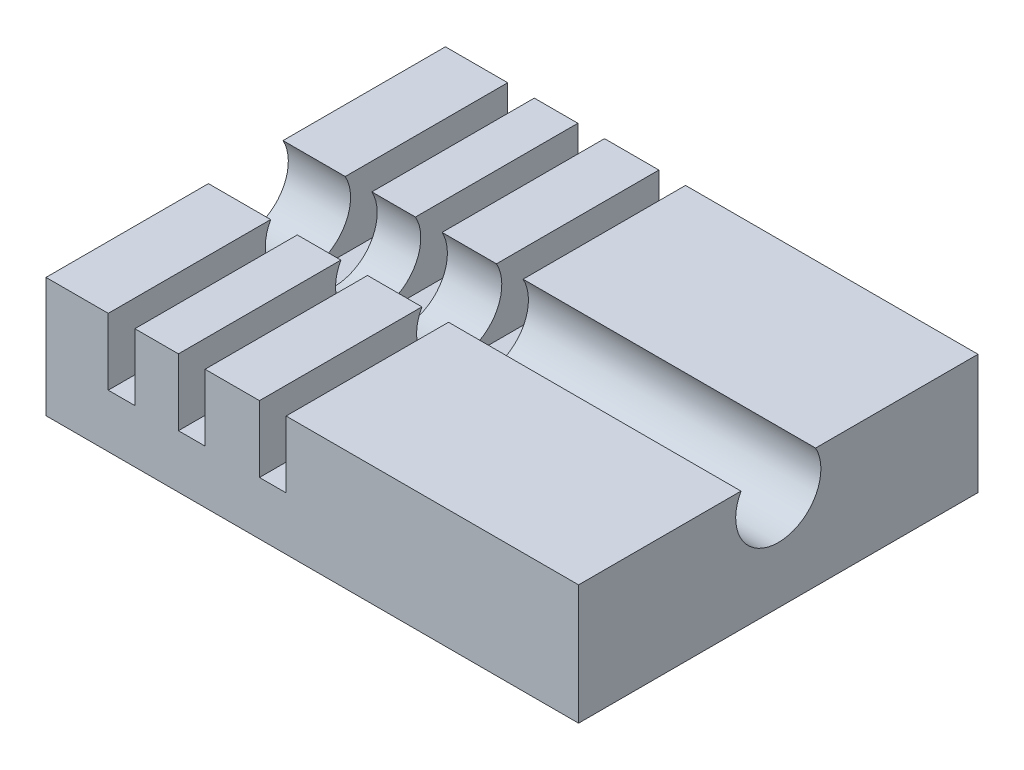
from build123d import *

# Parameters (mm, degrees)
SKETCH1_W           = 20
SKETCH1_H           = 15
BOSS_EXTRUDE1_DEPTH = 4.5
SKETCH3_R           = 1.6
CUT_EXTRUDE1_DEPTH  = 20
SKETCH4_W           = 1
SKETCH4_H           = 15
CUT_EXTRUDE2_DEPTH  = 2.5
SKETCH5_W           = 1
SKETCH5_H           = 15
CUT_EXTRUDE3_DEPTH  = 2.5
SKETCH6_W           = 1
SKETCH6_H           = 15
CUT_EXTRUDE5_DEPTH  = 2.5


with BuildPart() as part:
    # Sketch1 → Boss-Extrude1 (new body)
    with BuildSketch(Plane(origin=(0, 0, 0), x_dir=(1, 0, 0), z_dir=(0, 1, 0))):
        Rectangle(SKETCH1_W, SKETCH1_H)
    extrude(amount=BOSS_EXTRUDE1_DEPTH)

    # Sketch3 → Cut-Extrude1 (cut)
    with BuildSketch(Plane(origin=(10, 0, 0), x_dir=(0, 0, -1), z_dir=(1, 0, 0))):
        with Locations((0, 3.72608181)):
            Circle(SKETCH3_R)
    extrude(amount=-CUT_EXTRUDE1_DEPTH, mode=Mode.SUBTRACT)

    # Sketch4 → Cut-Extrude2 (cut)
    with BuildSketch(Plane(origin=(0, 4.5, 0), x_dir=(1, 0, 0), z_dir=(0, 1, 0))):
        with Locations((-7.162357261, 0)):
            Rectangle(SKETCH4_W, SKETCH4_H)
    extrude(amount=-CUT_EXTRUDE2_DEPTH, mode=Mode.SUBTRACT)

    # Sketch5 → Cut-Extrude3 (cut)
    with BuildSketch(Plane(origin=(0, 4.5, 0), x_dir=(1, 0, 0), z_dir=(0, 1, 0))):
        with Locations((-4.526212298, 0)):
            Rectangle(SKETCH5_W, SKETCH5_H)
    extrude(amount=-CUT_EXTRUDE3_DEPTH, mode=Mode.SUBTRACT)

    # Sketch6 → Cut-Extrude5 (cut)
    with BuildSketch(Plane(origin=(0, 4.5, 0), x_dir=(1, 0, 0), z_dir=(0, 1, 0))):
        with Locations((-1.483369352, 0)):
            Rectangle(SKETCH6_W, SKETCH6_H)
    extrude(amount=-CUT_EXTRUDE5_DEPTH, mode=Mode.SUBTRACT)


solid = part.part
